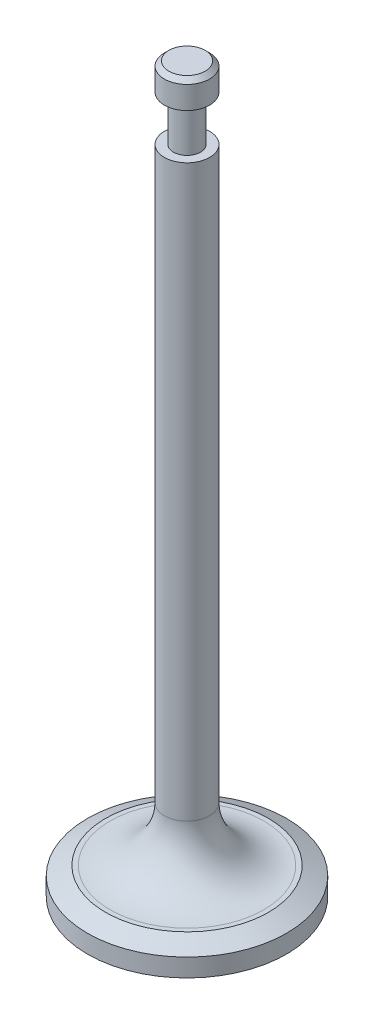
from build123d import *

# Parameters (mm, degrees)
FILLET1_R      = 24
CHAMFER1_SIZE  = 4
CHAMFER1_SIZE2 = 8
CHAMFER2_SIZE  = 2


with BuildPart() as part:
    # Sketch1 → Revolve1 (revolve)
    with BuildSketch(Plane(origin=(0, 0, 0), x_dir=(0, 0, -1), z_dir=(1, 0, 0)), mode=Mode.PRIVATE) as revolve1_sk:
        Polygon((0, 0), (0, -320), (44, -320), (44, -308), (10, -308), (10, -32), (6, -32), (6, -12), (10, -12), (10, 0), align=None)
    revolve(revolve1_sk.sketch.rotate(Axis((0, 0, 0), (0, -1, 0)), 180), axis=Axis((0, 0, 0), (0, -1, 0)))

    # Fillet1
    fillet1_edges = [part.edges().sort_by_distance(p)[0] for p in [
        (0, -308, -10),
    ]]
    fillet(fillet1_edges, radius=FILLET1_R)

    # Chamfer1
    chamfer1_edges = [part.edges().sort_by_distance(p)[0] for p in [
        (0, -308, -44),
    ]]
    chamfer1_side = [part.faces().sort_by_distance(p)[0] for p in [
        (0, -314, -44),
    ]]
    chamfer(chamfer1_edges, length=CHAMFER1_SIZE, length2=CHAMFER1_SIZE2, reference=chamfer1_side[0])

    # Chamfer2
    chamfer2_edges = [part.edges().sort_by_distance(p)[0] for p in [
        (0, 0, -10),
    ]]
    chamfer(chamfer2_edges, length=CHAMFER2_SIZE)


solid = part.part
